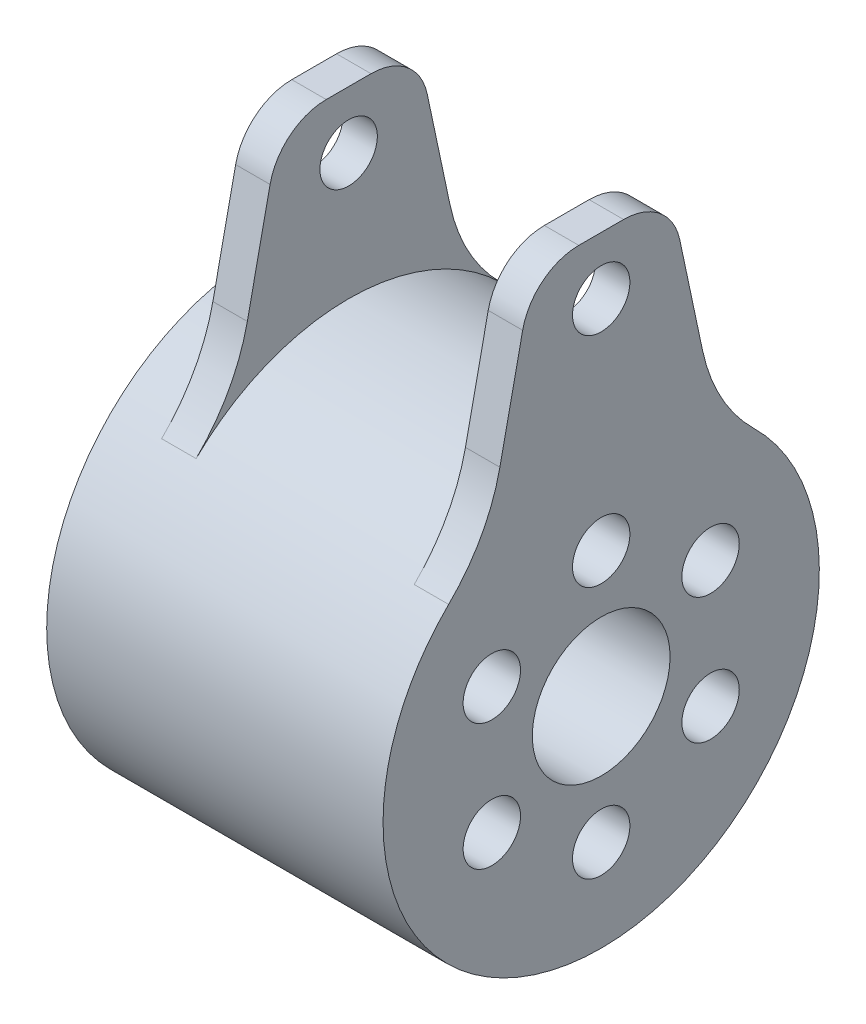
from build123d import *
from build123d.topology import SkipClean

# Parameters (mm, degrees)
SKETCH_1_R          = 19
SKETCH_1_R_2        = 2
SKETCH_1_R_3        = 11
EXTRUDE_1_DEPTH     = 3
EXTRUDE_START       = -3
EXTRUDE_2_DEPTH     = 3
FILLET_1_R          = 3
SKETCH_5_R          = 2.5
EXTRUDE_3_DEPTH     = 3
FILLET_2_R          = 16
FILLET_3_R          = 5
EXTRUDE_START_2     = 8
SKETCH_8_R          = 19
SKETCH_8_R_2        = 2
EXTRUDE_5_DEPTH     = 8
SKETCH_9_R          = 2
SKETCH_9_R_2        = 2.5
EXTRUDE_6_DEPTH     = 25
CUT_EXTRUDE_START   = -19
CUT_EXTRUDE_1_DEPTH = 19
EXTRUDE_START_3     = -36
SKETCH_12_R         = 19
SKETCH_12_R_2       = 11
EXTRUDE_7_DEPTH     = 36
SKETCH_13_R         = 6
EXTRUDE_8_DEPTH     = 36
CUT_EXTRUDE_START_2 = -36
SKETCH_14_R         = 2.5
CUT_EXTRUDE_2_DEPTH = 36
SKETCH_15_R         = 28.71288773
CUT_EXTRUDE_3_DEPTH = 6.7
SKETCH_17_R         = 2
SKETCH_17_R_2       = 1.5
EXTRUDE_9_DEPTH     = 3.8
CHAMFER_2_SIZE      = 0.5
CUT_EXTRUDE_START_3 = -3
CUT_EXTRUDE_4_DEPTH = 3


with BuildPart() as part:
    # 草图1 → 凸台-拉伸1 (new body)
    with BuildSketch(Plane(origin=(0, 0, 0), x_dir=(0, 0, -1), z_dir=(1, 0, 0))):
        Circle(SKETCH_1_R)
        with Locations((0, -15)):
            Circle(SKETCH_1_R_2, mode=Mode.SUBTRACT)
        with Locations((0, 13.5)):
            Circle(SKETCH_1_R_2, mode=Mode.SUBTRACT)
        with Locations((11.691342951, -6.75)):
            Circle(SKETCH_1_R_2, mode=Mode.SUBTRACT)
        with Locations((-12.990381057, 7.5)):
            Circle(SKETCH_1_R_2, mode=Mode.SUBTRACT)
        with Locations((-11.691342951, -6.75)):
            Circle(SKETCH_1_R_2, mode=Mode.SUBTRACT)
        with Locations((12.990381057, 7.5)):
            Circle(SKETCH_1_R_2, mode=Mode.SUBTRACT)
        Circle(SKETCH_1_R_3, mode=Mode.SUBTRACT)
    extrude(amount=EXTRUDE_1_DEPTH)

    # 草图3 → 凸台-拉伸2 (add)
    with BuildSketch(Plane(origin=(3, 0, 0), x_dir=(0, 0, -1), z_dir=(1, 0, 0)).offset(EXTRUDE_START)):
        with BuildLine():
            ThreePointArc((-2.795361016, 10.638888889), (0, 9.5), (2.795361016, 10.638888889))
            ThreePointArc((2.795361016, 10.638888889), (0, 11), (-2.795361016, 10.638888889))
        make_face()
        with BuildLine():
            ThreePointArc((10.611228554, -2.898590792), (8.227241336, -4.75), (7.815867538, -7.740298097))
            ThreePointArc((7.815867538, -7.740298097), (9.526279442, -5.5), (10.611228554, -2.898590792))
        make_face()
        with BuildLine():
            ThreePointArc((-7.815867538, -7.740298097), (-8.227241336, -4.75), (-10.611228554, -2.898590792))
            ThreePointArc((-10.611228554, -2.898590792), (-9.526279442, -5.5), (-7.815867538, -7.740298097))
        make_face()
    extrude(amount=EXTRUDE_2_DEPTH)

    # 圆角1
    fillet_1_edges = [part.edges().sort_by_distance(p)[0] for p in [
        (1.5, 10.638888889, 2.795361016),
        (1.5, 10.638888889, -2.795361016),
        (1.5, -2.898590792, -10.611228554),
        (1.5, -7.740298097, -7.815867538),
        (1.5, -7.740298097, 7.815867538),
        (1.5, -2.898590792, 10.611228554),
    ]]
    fillet(fillet_1_edges, radius=FILLET_1_R)

    # 草图5 → 凸台-拉伸3 (add)
    with BuildSketch(Plane(origin=(3, 0, 0), x_dir=(0, 0, -1), z_dir=(1, 0, 0)).offset(EXTRUDE_START)):
        with BuildLine():
            Line((-6, 35), (-10, 16.155494421))
            ThreePointArc((-10, 16.155494421), (0, 19), (10, 16.155494421))
            Line((10, 16.155494421), (6, 35))
            Line((6, 35), (-6, 35))
        make_face()
        with Locations((0, 30)):
            Circle(SKETCH_5_R, mode=Mode.SUBTRACT)
    extrude(amount=EXTRUDE_3_DEPTH)

    # 圆角2
    fillet_2_edges = [part.edges().sort_by_distance(p)[0] for p in [
        (1.5, 16.155494421, 10),
        (1.5, 16.155494421, -10),
    ]]
    fillet(fillet_2_edges, radius=FILLET_2_R)

    # 圆角3
    fillet_3_edges = [part.edges().sort_by_distance(p)[0] for p in [
        (1.5, 35, -6),
        (1.5, 35, 6),
    ]]
    fillet(fillet_3_edges, radius=FILLET_3_R)

    # 草图8 → 凸台-拉伸5 (add)
    with BuildSketch(Plane.ZY.offset(EXTRUDE_START_2)):
        Circle(SKETCH_8_R)
        with Locations((0, -15)):
            Circle(SKETCH_8_R_2, mode=Mode.SUBTRACT)
        with Locations((-11.691342951, -6.75)):
            Circle(SKETCH_8_R_2, mode=Mode.SUBTRACT)
        with Locations((11.691342951, -6.75)):
            Circle(SKETCH_8_R_2, mode=Mode.SUBTRACT)
        with Locations((12.990381057, 7.5)):
            Circle(SKETCH_8_R_2, mode=Mode.SUBTRACT)
        with Locations((0, 13.5)):
            Circle(SKETCH_8_R_2, mode=Mode.SUBTRACT)
        with Locations((-12.990381057, 7.5)):
            Circle(SKETCH_8_R_2, mode=Mode.SUBTRACT)
        with BuildLine():
            ThreePointArc((9.557371648, -3.366781639), (10.505068504, -2.412656367), (10.940728111, -1.140380819))
            ThreePointArc((10.940728111, -1.140380819), (9.526279442, 5.5), (4.482765296, 10.045138889))
            ThreePointArc((4.482765296, 10.045138889), (3.163112547, 10.303984377), (1.862967396, 9.96031746))
            ThreePointArc((1.862967396, 9.96031746), (0, 9.5), (-1.862967396, 9.96031746))
            ThreePointArc((-1.862967396, 9.96031746), (-3.163112547, 10.303984377), (-4.482765296, 10.045138889))
            ThreePointArc((-4.482765296, 10.045138889), (-9.526279442, 5.5), (-10.940728111, -1.140380819))
            ThreePointArc((-10.940728111, -1.140380819), (-10.505068504, -2.412656367), (-9.557371648, -3.366781639))
            ThreePointArc((-9.557371648, -3.366781639), (-8.227241336, -4.75), (-7.694404252, -6.593535821))
            ThreePointArc((-7.694404252, -6.593535821), (-7.341955957, -7.89132801), (-6.457962814, -8.90475807))
            ThreePointArc((-6.457962814, -8.90475807), (0, -11), (6.457962814, -8.90475807))
            ThreePointArc((6.457962814, -8.90475807), (7.341955957, -7.89132801), (7.694404252, -6.593535821))
            ThreePointArc((7.694404252, -6.593535821), (8.227241336, -4.75), (9.557371648, -3.366781639))
        make_face(mode=Mode.SUBTRACT)
    extrude(amount=-EXTRUDE_5_DEPTH)

    # 草图9 → 凸台-拉伸6 (add)
    with BuildSketch(Plane(origin=(3, 0, 0), x_dir=(0, 0, -1), z_dir=(1, 0, 0))):
        with BuildLine():
            Line((8.823674386, 21.697313072), (6.840948182, 31.038186825))
            ThreePointArc((6.840948182, 31.038186825), (5.097065624, 33.885288543), (1.94991883, 35))
            Line((1.94991883, 35), (-1.94991883, 35))
            ThreePointArc((-1.94991883, 35), (-5.097065624, 33.885288543), (-6.840948182, 31.038186825))
            Line((-6.840948182, 31.038186825), (-8.823674386, 21.697313072))
            ThreePointArc((-8.823674386, 21.697313072), (-10.455022048, 17.309705025), (-13.286411369, 13.582020209))
            ThreePointArc((-13.286411369, 13.582020209), (0, -19), (13.286411369, 13.582020209))
            ThreePointArc((13.286411369, 13.582020209), (10.455022048, 17.309705025), (8.823674386, 21.697313072))
        make_face()
        with Locations(Location((0, -15, 0), (0, 0, 180))):
            Circle(SKETCH_9_R, mode=Mode.SUBTRACT)
        with Locations(Location((11.691342951, -6.75, 0), (0, 0, 180))):
            Circle(SKETCH_9_R, mode=Mode.SUBTRACT)
        with Locations(Location((-11.691342951, -6.75, 0), (0, 0, 180))):
            Circle(SKETCH_9_R, mode=Mode.SUBTRACT)
        with Locations(Location((12.990381057, 7.5, 0), (0, 0, 180))):
            Circle(SKETCH_9_R, mode=Mode.SUBTRACT)
        with Locations(Location((-12.990381057, 7.5, 0), (0, 0, 180))):
            Circle(SKETCH_9_R, mode=Mode.SUBTRACT)
        with Locations(Location((0, 13.5, 0), (0, 0, 180))):
            Circle(SKETCH_9_R, mode=Mode.SUBTRACT)
        with Locations((0, 30)):
            Circle(SKETCH_9_R_2, mode=Mode.SUBTRACT)
        with BuildLine():
            ThreePointArc((6.457962814, -8.90475807), (7.341955957, -7.89132801), (7.694404252, -6.593535821))
            ThreePointArc((7.694404252, -6.593535821), (8.227241336, -4.75), (9.557371648, -3.366781639))
            ThreePointArc((9.557371648, -3.366781639), (10.505068504, -2.412656367), (10.940728111, -1.140380819))
            ThreePointArc((10.940728111, -1.140380819), (9.526279442, 5.5), (4.482765296, 10.045138889))
            ThreePointArc((4.482765296, 10.045138889), (3.163112547, 10.303984377), (1.862967396, 9.96031746))
            ThreePointArc((1.862967396, 9.96031746), (0, 9.5), (-1.862967396, 9.96031746))
            ThreePointArc((-1.862967396, 9.96031746), (-3.163112547, 10.303984377), (-4.482765296, 10.045138889))
            ThreePointArc((-4.482765296, 10.045138889), (-9.526279442, 5.5), (-10.940728111, -1.140380819))
            ThreePointArc((-10.940728111, -1.140380819), (-10.505068504, -2.412656367), (-9.557371648, -3.366781639))
            ThreePointArc((-9.557371648, -3.366781639), (-8.227241336, -4.75), (-7.694404252, -6.593535821))
            ThreePointArc((-7.694404252, -6.593535821), (-7.341955957, -7.89132801), (-6.457962814, -8.90475807))
            ThreePointArc((-6.457962814, -8.90475807), (0, -11), (6.457962814, -8.90475807))
        make_face(mode=Mode.SUBTRACT)
    extrude(amount=EXTRUDE_6_DEPTH)

    # 草图11 → 切除-拉伸1 (cut)
    with BuildSketch(Plane.ZY.offset(-6).offset(CUT_EXTRUDE_START)):
        with BuildLine():
            Line((-6.840948182, 31.038186825), (-8.823674386, 21.697313072))
            ThreePointArc((-8.823674386, 21.697313072), (-10.455022048, 17.309705025), (-13.286411369, 13.582020209))
            ThreePointArc((-13.286411369, 13.582020209), (0, 19), (13.286411369, 13.582020209))
            ThreePointArc((13.286411369, 13.582020209), (10.455022048, 17.309705025), (8.823674386, 21.697313072))
            Line((8.823674386, 21.697313072), (6.840948182, 31.038186825))
            ThreePointArc((6.840948182, 31.038186825), (5.097065624, 33.885288543), (1.94991883, 35))
            Line((1.94991883, 35), (-1.94991883, 35))
            ThreePointArc((-1.94991883, 35), (-5.097065624, 33.885288543), (-6.840948182, 31.038186825))
        make_face()
    extrude(amount=CUT_EXTRUDE_1_DEPTH, mode=Mode.SUBTRACT)

    # 草图12 → 凸台-拉伸7 (add)
    with BuildSketch(Plane(origin=(28, 0, 0), x_dir=(0, 0, -1), z_dir=(1, 0, 0)).offset(EXTRUDE_START_3)):
        with Locations(Location((0, 0, 0), (0, 0, 180))):
            Circle(SKETCH_12_R)
        Circle(SKETCH_12_R_2, mode=Mode.SUBTRACT)
    extrude(amount=EXTRUDE_7_DEPTH)

    # 草图13 → 凸台-拉伸8 (add)
    with BuildSketch(Plane(origin=(28, 0, 0), x_dir=(0, 0, -1), z_dir=(1, 0, 0)).offset(EXTRUDE_START_3)):
        with BuildLine():
            ThreePointArc((-10.522152508, 3.206915432), (-11, 0), (-10.522152508, -3.206915432))
            ThreePointArc((-10.522152508, -3.206915432), (-7.361215932, -4.25), (-8.038346486, -7.508993659))
            ThreePointArc((-8.038346486, -7.508993659), (-5.5, -9.526279442), (-2.483806022, -10.715909091))
            ThreePointArc((-2.483806022, -10.715909091), (0, -8.5), (2.483806022, -10.715909091))
            ThreePointArc((2.483806022, -10.715909091), (5.5, -9.526279442), (8.038346486, -7.508993659))
            ThreePointArc((8.038346486, -7.508993659), (7.361215932, -4.25), (10.522152508, -3.206915432))
            ThreePointArc((10.522152508, -3.206915432), (11, 0), (10.522152508, 3.206915432))
            ThreePointArc((10.522152508, 3.206915432), (7.361215932, 4.25), (8.038346486, 7.508993659))
            ThreePointArc((8.038346486, 7.508993659), (5.5, 9.526279442), (2.483806022, 10.715909091))
            ThreePointArc((2.483806022, 10.715909091), (0, 8.5), (-2.483806022, 10.715909091))
            ThreePointArc((-2.483806022, 10.715909091), (-5.5, 9.526279442), (-8.038346486, 7.508993659))
            ThreePointArc((-8.038346486, 7.508993659), (-7.361215932, 4.25), (-10.522152508, 3.206915432))
        make_face()
        Circle(SKETCH_13_R, mode=Mode.SUBTRACT)
    extrude(amount=EXTRUDE_8_DEPTH)

    # 草图14 → 切除-拉伸2 (cut)
    with SkipClean():  # the faces are left unmerged after this step: merging them gives an invalid solid
        with BuildSketch(Plane(origin=(28, 0, 0), x_dir=(0, 0, -1), z_dir=(1, 0, 0)).offset(CUT_EXTRUDE_START_2)):
            with Locations((0, 11)):
                Circle(SKETCH_14_R)
            with Locations((-9.526279442, 5.5)):
                Circle(SKETCH_14_R)
            with Locations((-9.526279442, -5.5)):
                Circle(SKETCH_14_R)
            with Locations((0, -11)):
                Circle(SKETCH_14_R)
            with Locations((9.526279442, -5.5)):
                Circle(SKETCH_14_R)
            with Locations((9.526279442, 5.5)):
                Circle(SKETCH_14_R)
        extrude(amount=CUT_EXTRUDE_2_DEPTH, mode=Mode.SUBTRACT)

    # 草图15 → 切除-拉伸3 (cut)
    with SkipClean():  # the faces are left unmerged after this step: merging them gives an invalid solid
        with BuildSketch(Plane.ZY.offset(8)):
            Circle(SKETCH_15_R)
        extrude(amount=-CUT_EXTRUDE_3_DEPTH, mode=Mode.SUBTRACT)

    # 草图17 → 凸台-拉伸9 (add)
    with SkipClean():  # the faces are left unmerged after this step: merging them gives an invalid solid
        with BuildSketch(Plane.ZY.offset(1.3)):
            with Locations(Location((-5.5, -9.526279442, 0), (0, 0, 180))):
                Circle(SKETCH_17_R)
            with Locations(Location((-5.5, 9.526279442, 0), (0, 0, 180))):
                Circle(SKETCH_17_R_2)
            with Locations(Location((5.5, 9.526279442, 0), (0, 0, 180))):
                Circle(SKETCH_17_R)
            with Locations(Location((5.5, -9.526279442, 0), (0, 0, 180))):
                Circle(SKETCH_17_R_2)
        extrude(amount=EXTRUDE_9_DEPTH)

    # 倒角2
    chamfer_2_edges = [part.edges().sort_by_distance(p)[0] for p in [
        (-5.1, -9.526279442, -3.5),
        (-5.1, 9.526279442, -4),
        (-5.1, 9.526279442, 7.5),
        (-5.1, -9.526279442, 7),
    ]]
    chamfer(chamfer_2_edges, length=CHAMFER_2_SIZE)

    # 草图19 → 切除-拉伸4 (cut)
    with SkipClean():  # the faces are left unmerged after this step: merging them gives an invalid solid
        with BuildSketch(Plane.ZY.offset(CUT_EXTRUDE_START_3)):
            with BuildLine():
                Line((8.823674386, 21.697313072), (6.840948182, 31.038186825))
                ThreePointArc((6.840948182, 31.038186825), (5.097065624, 33.885288543), (1.94991883, 35))
                Line((1.94991883, 35), (-1.94991883, 35))
                ThreePointArc((-1.94991883, 35), (-5.097065624, 33.885288543), (-6.840948182, 31.038186825))
                Line((-6.840948182, 31.038186825), (-8.823674386, 21.697313072))
                ThreePointArc((-8.823674386, 21.697313072), (-10.455022048, 17.309705025), (-13.286411369, 13.582020209))
                ThreePointArc((-13.286411369, 13.582020209), (0, 19), (13.286411369, 13.582020209))
                ThreePointArc((13.286411369, 13.582020209), (10.455022048, 17.309705025), (8.823674386, 21.697313072))
            make_face()
        extrude(amount=CUT_EXTRUDE_4_DEPTH, mode=Mode.SUBTRACT)


solid = part.part
